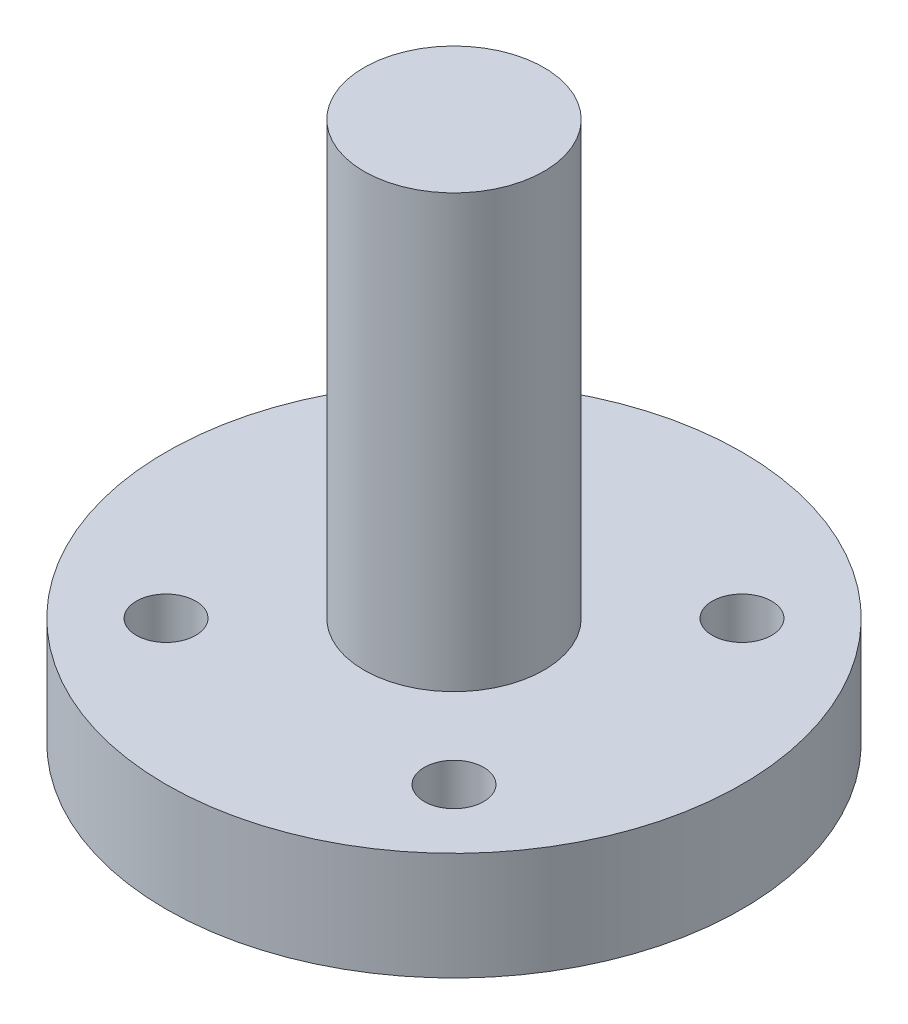
from build123d import *

# Parameters (mm, degrees)
SKETCH1_R                   = 16
BOSS_EXTRUDE1_DEPTH         = 6
TAP_DRILL_FOR_M4X0_7_TAP1_D = 3.3
SKETCH3_R                   = 5
BOSS_EXTRUDE2_DEPTH         = 24


with BuildPart() as part:
    # Sketch1 → Boss-Extrude1 (new body)
    with BuildSketch(Plane(origin=(0, 0, 0), x_dir=(1, 0, 0), z_dir=(0, 1, 0))):
        with Locations(Location((0, 0, 0), (0, 0, 270))):
            Circle(SKETCH1_R)
    extrude(amount=BOSS_EXTRUDE1_DEPTH)

    # Tap Drill for M4x0.7 Tap1 (through all)
    with Locations(Plane(origin=(0, 0, 0), x_dir=(-1, 0, 0), z_dir=(0, -1, 0))):
        with Locations((-8, 8), (-8, -8), (8, -8), (8, 8)):
            Hole(TAP_DRILL_FOR_M4X0_7_TAP1_D / 2)

    # Sketch3 → Boss-Extrude2 (add)
    with BuildSketch(Plane(origin=(0, 6, 0), x_dir=(1, 0, 0), z_dir=(0, 1, 0))):
        with Locations(Location((0, 0, 0), (0, 0, 270))):
            Circle(SKETCH3_R)
    extrude(amount=BOSS_EXTRUDE2_DEPTH)


solid = part.part
